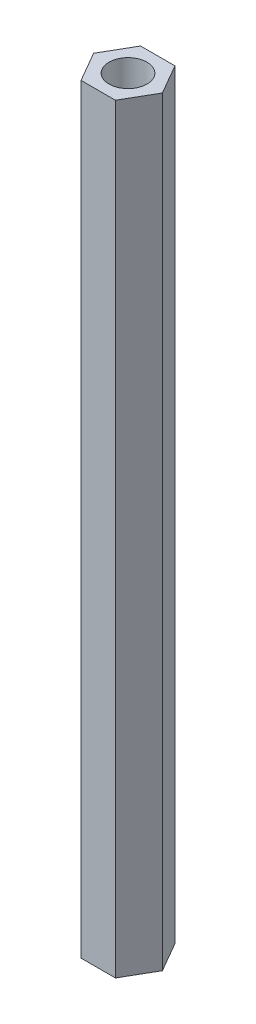
from build123d import *

# Parameters (mm, degrees)
SKETCH_1_R      = 1.5
EXTRUDE_1_DEPTH = 60


with BuildPart() as part:
    # 草图1 → 凸台-拉伸1 (new body)
    with BuildSketch(Plane(origin=(0, 0, 0), x_dir=(1, 0, 0), z_dir=(0, 1, 0))):
        Polygon((2.713546265, 0), (1.356773133, 2.35), (-1.356773133, 2.35), (-2.713546265, 0), (-1.356773133, -2.35), (1.356773133, -2.35), align=None)
        with Locations(Location((0, 0, 0), (0, 0, 270))):
            Circle(SKETCH_1_R, mode=Mode.SUBTRACT)
    extrude(amount=EXTRUDE_1_DEPTH)


solid = part.part
